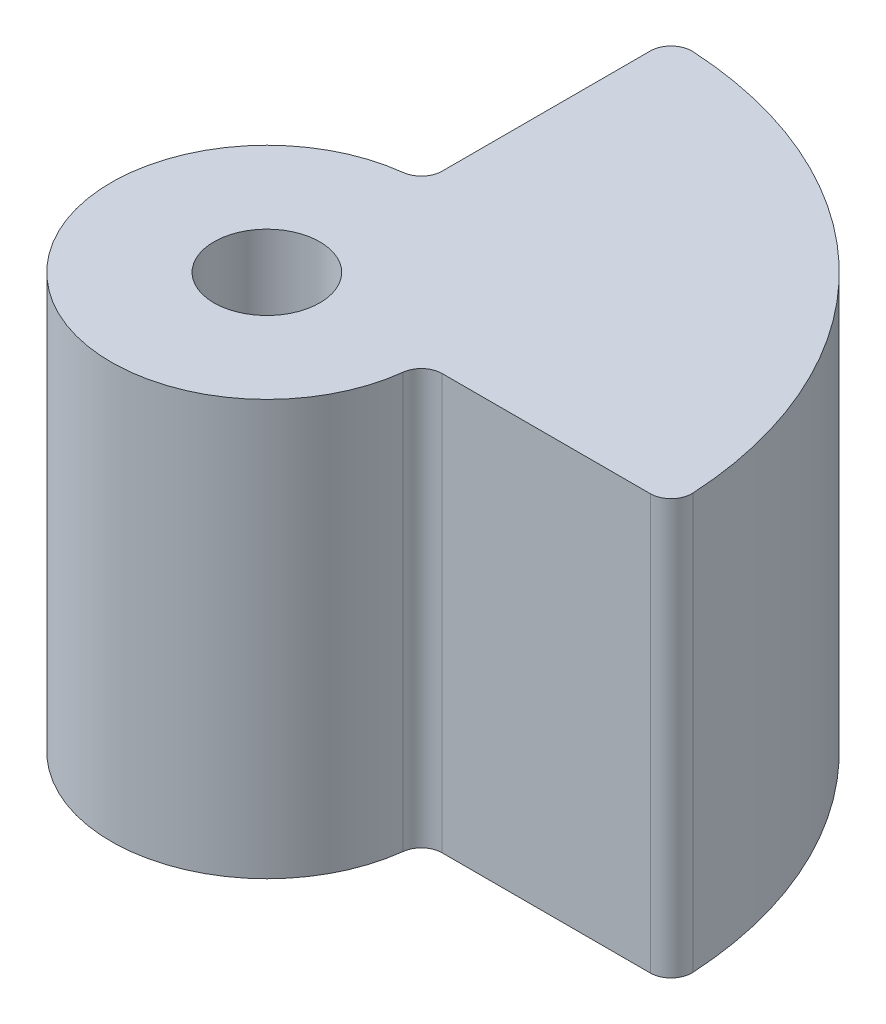
from build123d import *

# Parameters (mm, degrees)
BOSS_EXTRUDE2_DEPTH = 20
SKETCH2_R           = 2.55
CUT_EXTRUDE1_DEPTH  = 20
FILLET1_R           = 1


with BuildPart() as part:
    # Sketch1 → Boss-Extrude2 (new body)
    with BuildSketch(Plane(origin=(0, 0, 0), x_dir=(1, 0, 0), z_dir=(0, 1, 0))):
        with BuildLine():
            Line((7.5, 0), (19.5, 0))
            ThreePointArc((19.5, 0), (13.788582233, 13.788582233), (0, 19.5))
            Line((0, 19.5), (0, 7.5))
            ThreePointArc((0, 7.5), (-5.303300859, -5.303300859), (7.5, 0))
        make_face()
    extrude(amount=BOSS_EXTRUDE2_DEPTH)

    # Sketch2 → Cut-Extrude1 (cut)
    with BuildSketch(Plane(origin=(0, 20, 0), x_dir=(1, 0, 0), z_dir=(0, 1, 0))):
        with Locations(Location((0, 0, 0), (0, 0, 270))):
            Circle(SKETCH2_R)
    extrude(amount=-CUT_EXTRUDE1_DEPTH, mode=Mode.SUBTRACT)

    # Fillet1
    fillet1_edges = [part.edges().sort_by_distance(p)[0] for p in [
        (0, 10, -7.5),
        (0, 10, -19.5),
        (19.5, 10, 0),
        (7.5, 10, 0),
    ]]
    fillet(fillet1_edges, radius=FILLET1_R)


solid = part.part
